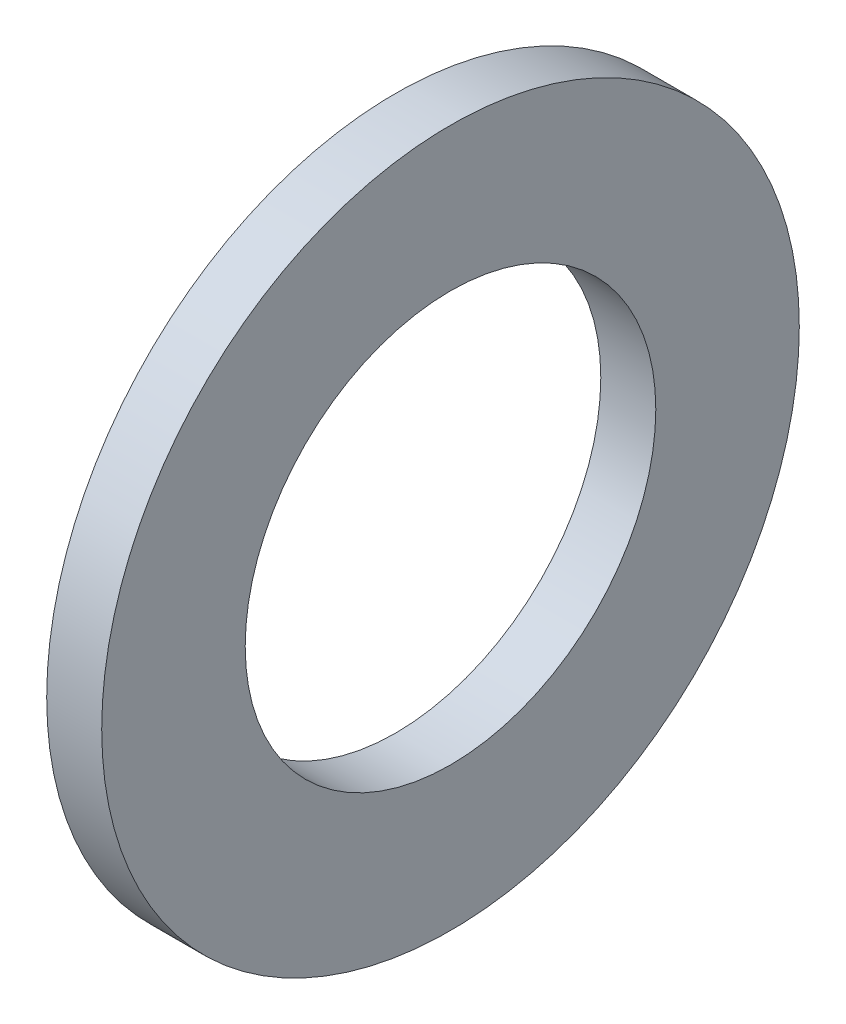
from build123d import *

# Parameters (mm, degrees)
SKETCH1_R           = 11.1125
SKETCH1_R_2         = 6.5405
BOSS_EXTRUDE1_DEPTH = 1.7526


with BuildPart() as part:
    # Sketch1 → Boss-Extrude1 (new body)
    with BuildSketch(Plane(origin=(0, 0, 0), x_dir=(0, 0, -1), z_dir=(1, 0, 0))):
        Circle(SKETCH1_R)
        Circle(SKETCH1_R_2, mode=Mode.SUBTRACT)
    extrude(amount=BOSS_EXTRUDE1_DEPTH)


solid = part.part
